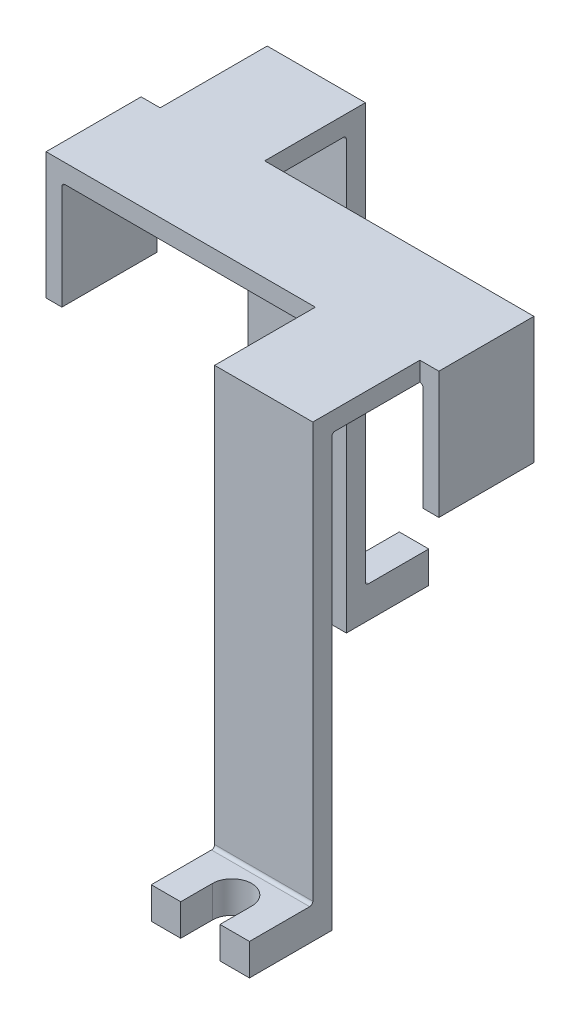
from build123d import *

# Parameters (mm, degrees)
SALIENTE_EXTRUIR1_DEPTH = 3
CROQUIS2_W              = 3
CROQUIS2_H              = 15
SALIENTE_EXTRUIR2_DEPTH = 3
CROQUIS3_W              = 2.5
CROQUIS3_H              = 15
SALIENTE_EXTRUIR3_DEPTH = 17
CROQUIS4_W              = 15.5
CROQUIS4_H              = 3
SALIENTE_EXTRUIR4_DEPTH = 68
CROQUIS5_W              = 15.5
CROQUIS5_H              = 5
SALIENTE_EXTRUIR5_DEPTH = 10
CROQUIS6_W              = 15.5
CROQUIS6_H              = 5
SALIENTE_EXTRUIR6_DEPTH = 10
CORTAR_EXTRUIR1_DEPTH   = 10
CORTAR_EXTRUIR2_DEPTH   = 10
REDONDEO2_R             = 0.5


with BuildPart() as part:
    # Croquis1 → Saliente-Extruir1 (new body)
    with BuildSketch(Plane(origin=(0, 0, 0), x_dir=(1, 0, 0), z_dir=(0, 1, 0))):
        Polygon((-28.106357332, -8.17639486), (11.393642668, -8.17639486), (11.393642668, -24.07639486), (26.893642668, -24.07639486), (26.893642668, -7.17639486), (26.893642668, 7.82360514), (-12.606357332, 7.82360514), (-12.606357332, 23.72360514), (-28.106357332, 23.72360514), (-28.106357332, 6.82360514), align=None)
    extrude(amount=SALIENTE_EXTRUIR1_DEPTH)

    # Croquis2 → Saliente-Extruir2 (add)
    with BuildSketch(Plane(origin=(0, 3, 0), x_dir=(1, 0, 0), z_dir=(0, 1, 0))):
        with Locations((28.393642668, 0.32360514)):
            Rectangle(CROQUIS2_W, CROQUIS2_H)
        with Locations((-29.606357332, -0.67639486)):
            Rectangle(CROQUIS2_W, CROQUIS2_H)
    extrude(amount=-SALIENTE_EXTRUIR2_DEPTH)

    # Croquis3 → Saliente-Extruir3 (add)
    with BuildSketch(Plane.XZ):
        with Locations((-29.856357332, 0.67639486)):
            Rectangle(CROQUIS3_W, CROQUIS3_H)
        with Locations((28.643642668, -0.32360514)):
            Rectangle(CROQUIS3_W, CROQUIS3_H)
    extrude(amount=SALIENTE_EXTRUIR3_DEPTH)

    # Croquis4 → Saliente-Extruir4 (add)
    with BuildSketch(Plane.XZ):
        with Locations((-20.356357332, -22.22360514)):
            Rectangle(CROQUIS4_W, CROQUIS4_H)
        with Locations((19.143642668, 22.57639486)):
            Rectangle(CROQUIS4_W, CROQUIS4_H)
    extrude(amount=SALIENTE_EXTRUIR4_DEPTH)

    # Croquis5 → Saliente-Extruir5 (add)
    with BuildSketch(Plane(origin=(0, 0, -23.72360514), x_dir=(-1, 0, 0), z_dir=(0, 0, -1))):
        with Locations((20.356357332, -65.5)):
            Rectangle(CROQUIS5_W, CROQUIS5_H)
    extrude(amount=SALIENTE_EXTRUIR5_DEPTH)

    # Croquis6 → Saliente-Extruir6 (add)
    with BuildSketch(Plane.XY.offset(24.07639486)):
        with Locations((19.143642668, -65.5)):
            Rectangle(CROQUIS6_W, CROQUIS6_H)
    extrude(amount=SALIENTE_EXTRUIR6_DEPTH)

    # Croquis7 → Cortar-Extruir1 (cut)
    with BuildSketch(Plane(origin=(0, -63, 0), x_dir=(1, 0, 0), z_dir=(0, 1, 0))):
        with BuildLine():
            Line((16.043642668, -29.07639486), (16.043642668, -34.07639486))
            Line((16.043642668, -34.07639486), (22.243642668, -34.07639486))
            Line((22.243642668, -34.07639486), (22.243642668, -29.07639486))
            ThreePointArc((22.243642668, -29.07639486), (19.143642668, -25.97639486), (16.043642668, -29.07639486))
        make_face()
    extrude(amount=-CORTAR_EXTRUIR1_DEPTH, mode=Mode.SUBTRACT)

    # Croquis8 → Cortar-Extruir2 (cut)
    with BuildSketch(Plane(origin=(0, -63, 0), x_dir=(1, 0, 0), z_dir=(0, 1, 0))):
        with BuildLine():
            Line((-23.456357332, 28.72360514), (-23.456357332, 33.72360514))
            Line((-23.456357332, 33.72360514), (-17.256357332, 33.72360514))
            Line((-17.256357332, 33.72360514), (-17.256357332, 28.72360514))
            ThreePointArc((-17.256357332, 28.72360514), (-20.356357332, 25.62360514), (-23.456357332, 28.72360514))
        make_face()
    extrude(amount=-CORTAR_EXTRUIR2_DEPTH, mode=Mode.SUBTRACT)

    # Redondeo2
    redondeo2_edges = [part.edges().sort_by_distance(p)[0] for p in [
        (19.143642668, -63, 24.07639486),
        (19.143642668, 0, 21.07639486),
        (27.393642668, 0, -0.32360514),
        (-28.606357332, 0, 0.67639486),
        (-20.356357332, 0, -20.72360514),
        (-20.356357332, -63, -23.72360514),
    ]]
    fillet(redondeo2_edges, radius=REDONDEO2_R)


solid = part.part
